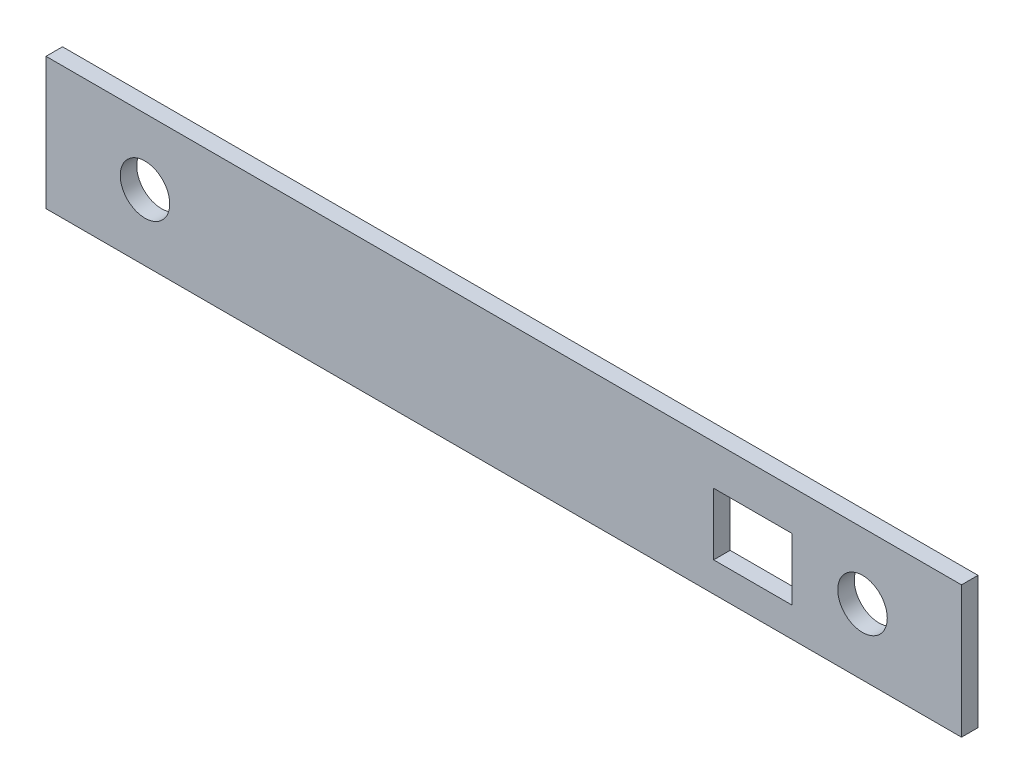
from build123d import *

# Parameters (mm, degrees)
SKETCH1_W           = 352.425
SKETCH1_H           = 50.8
SKETCH1_R           = 9.525
SKETCH1_W_2         = 30.145810139
SKETCH1_H_2         = 23.882232645
BOSS_EXTRUDE1_DEPTH = 6.35
SKETCH2_R           = 1.776231012
CUT_EXTRUDE1_DEPTH  = 19.304


with BuildPart() as part:
    # Sketch1 → Boss-Extrude1 (new body)
    with BuildSketch(Plane.XY):
        with Locations((176.2125, 25.4)):
            Rectangle(SKETCH1_W, SKETCH1_H)
        with Locations((38.1, 25.4)):
            Circle(SKETCH1_R, mode=Mode.SUBTRACT)
        with Locations((314.325, 25.4)):
            Circle(SKETCH1_R, mode=Mode.SUBTRACT)
        with Locations((272.079290139, 23.364723209)):
            Rectangle(SKETCH1_W_2, SKETCH1_H_2, mode=Mode.SUBTRACT)
    extrude(amount=BOSS_EXTRUDE1_DEPTH)

    # Sketch2 → Cut-Extrude1 (cut)
    with BuildSketch(Plane.XZ):
        with Locations(Location((238.759223147, 3.175, 0), (0, 0, 270))):
            Circle(SKETCH2_R)
    extrude(amount=-CUT_EXTRUDE1_DEPTH, mode=Mode.SUBTRACT)


solid = part.part
